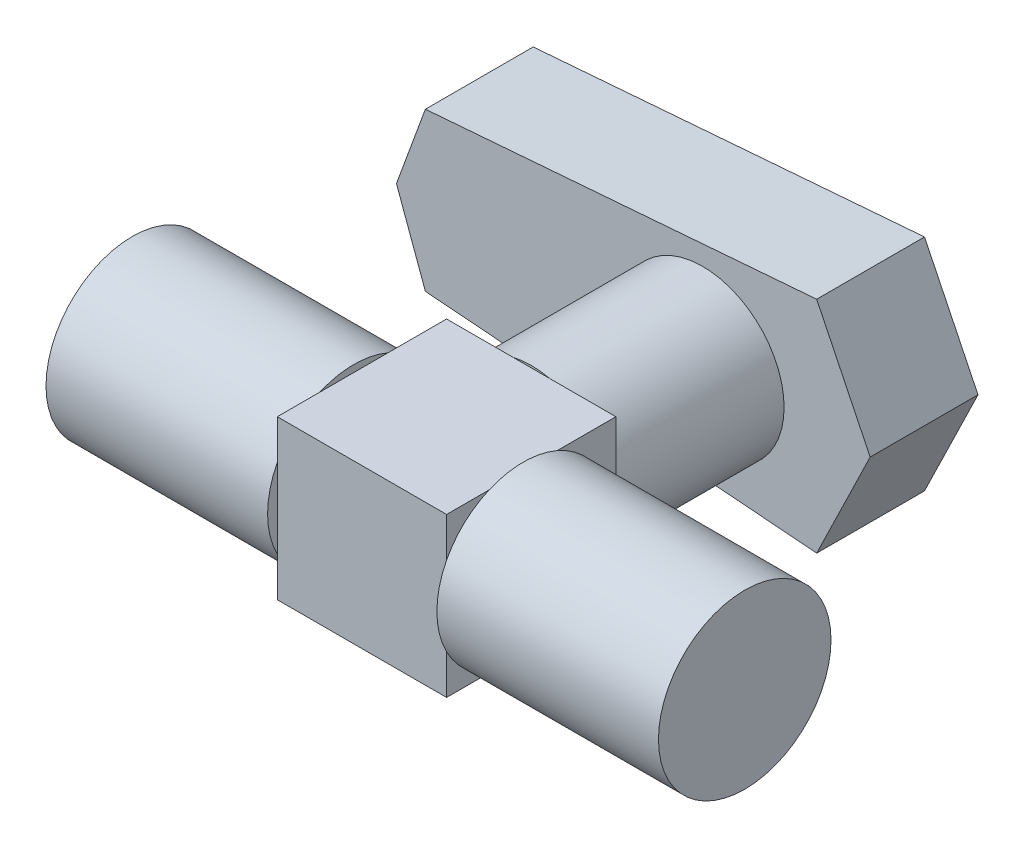
from build123d import *

# Parameters (mm, degrees)
BOSS_EXTRUDE2_DEPTH      = 7.35
BOSS_EXTRUDE2_DEPTH_BACK = 7.35
SKETCH2_W                = 15.7
SKETCH2_H                = 15.7
SKETCH3_R                = 8
BOSS_EXTRUDE3_DEPTH      = 20.55
SKETCH4_R                = 7.55
BOSS_EXTRUDE4_DEPTH      = 25.9
BOSS_EXTRUDE5_DEPTH      = 10


with BuildPart() as part:
    # Sketch2 → Boss-Extrude2 (new, two sides: drawn at the far end of the back side and taken through both)
    with BuildSketch(Plane(origin=(0, 0, 0), x_dir=(1, 0, 0), z_dir=(0, 1, 0)).offset(-BOSS_EXTRUDE2_DEPTH_BACK)):
        Rectangle(SKETCH2_W, SKETCH2_H)
    extrude(amount=BOSS_EXTRUDE2_DEPTH + BOSS_EXTRUDE2_DEPTH_BACK)

    # Sketch3 → Boss-Extrude3 (add)
    with BuildSketch(Plane(origin=(7.85, 0, 0), x_dir=(0, 0, -1), z_dir=(1, 0, 0))):
        with Locations((-0.75, 0)):
            Circle(SKETCH3_R)
    boss_extrude3 = extrude(amount=BOSS_EXTRUDE3_DEPTH)

    # Sketch4 → Boss-Extrude4 (add)
    with BuildSketch(Plane(origin=(0, 0, -7.85), x_dir=(-1, 0, 0), z_dir=(0, 0, -1))):
        Circle(SKETCH4_R)
    extrude(amount=BOSS_EXTRUDE4_DEPTH)

    # Sketch5 → Boss-Extrude5 (add)
    with BuildSketch(Plane(origin=(0, 0, -33.75), x_dir=(-1, 0, 0), z_dir=(0, 0, -1))):
        Polygon((-15.532193585, 0), (-10.572107213, -10.198544939), (25.717504309, -7.313596743), (28.4, 0), (25.717504309, 7.313596743), (-10.572107213, 10.198544939), align=None)
    extrude(amount=-BOSS_EXTRUDE5_DEPTH)

    # Mirror1: Boss-Extrude3 across plane
    add(boss_extrude3.mirror(Plane(origin=(0, 0, 0), x_dir=(0, 0, 1), z_dir=(1, 0, 0))))


solid = part.part
